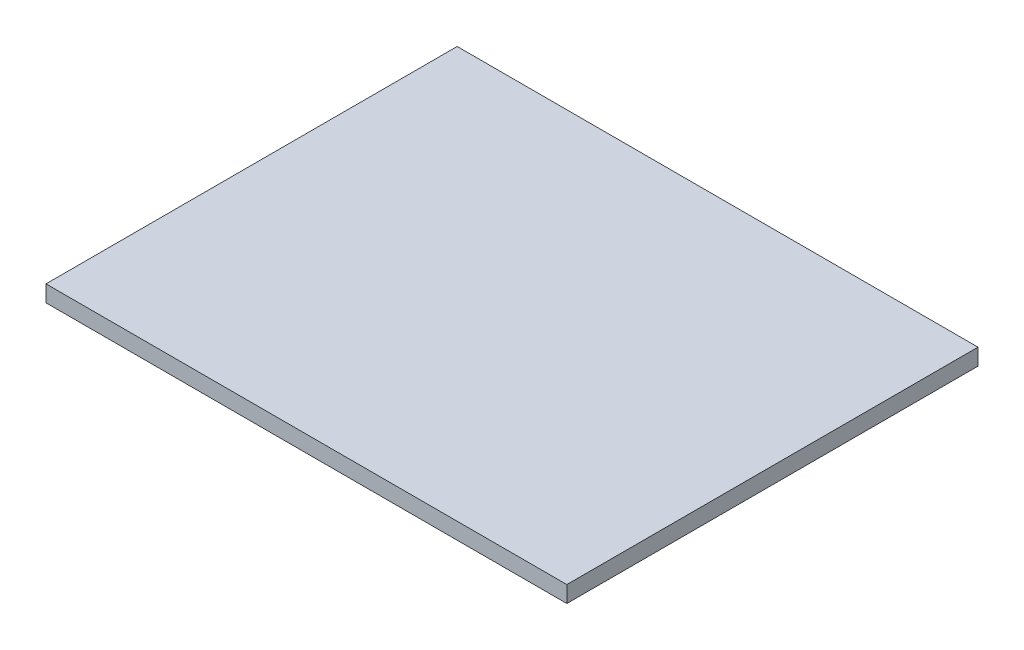
from build123d import *

# Parameters (mm, degrees)
SKETCH1_W           = 95
SKETCH1_H           = 75
BOSS_EXTRUDE1_DEPTH = 3


with BuildPart() as part:
    # Sketch1 → Boss-Extrude1 (new body)
    with BuildSketch(Plane(origin=(0, 0, 0), x_dir=(1, 0, 0), z_dir=(0, 1, 0))):
        Rectangle(SKETCH1_W, SKETCH1_H)
    extrude(amount=BOSS_EXTRUDE1_DEPTH)


solid = part.part
